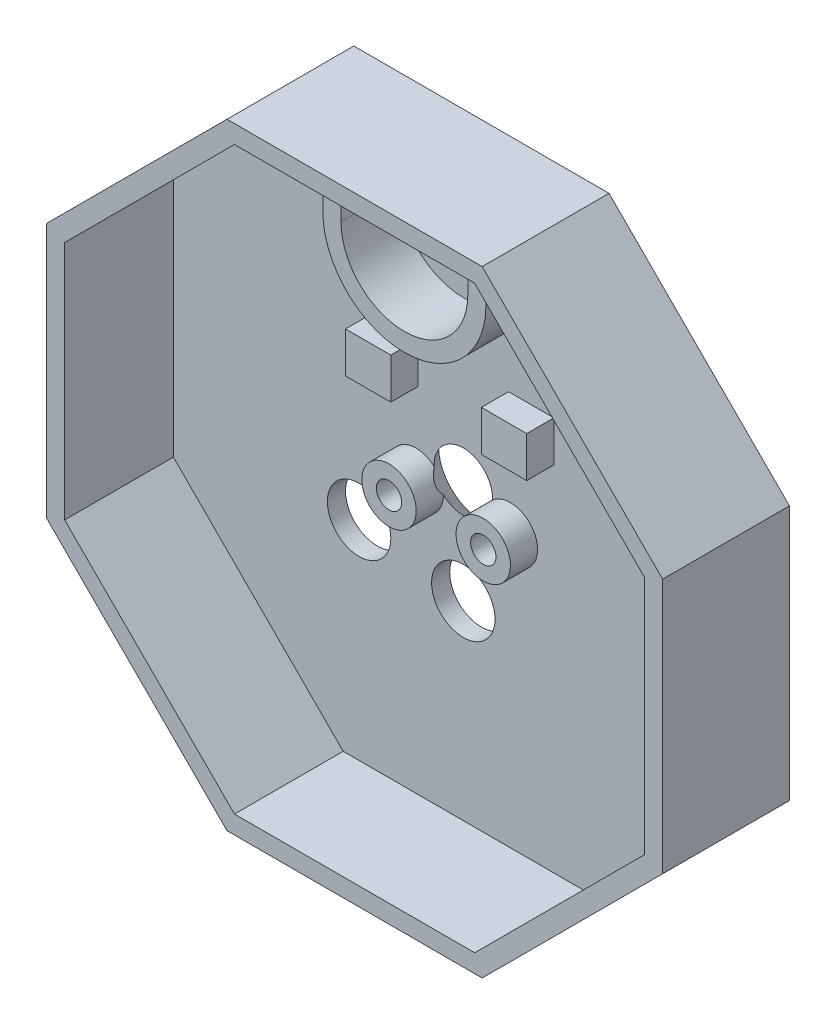
from build123d import *

# Parameters (mm, degrees)
BOSS_EXTRUDE1_DEPTH = 14
SHELL1_T            = -2
BOSS_EXTRUDE2_DEPTH = 6.5
SKETCH3_R           = 4.19
CUT_EXTRUDE1_DEPTH  = 50.558046773
SKETCH8_R           = 3
SKETCH8_R_2         = 1.4
BOSS_EXTRUDE3_DEPTH = 3
SKETCH9_W           = 5
SKETCH9_H           = 4.5
BOSS_EXTRUDE4_DEPTH = 3
SKETCH10_R          = 3.5
CUT_EXTRUDE2_DEPTH  = 51.079936102


with BuildPart() as part:
    # Sketch1 → Boss-Extrude1 (new body)
    with BuildSketch(Plane.XY):
        Polygon((34, -14.083261121), (34, 14.083261121), (14.083261121, 34), (-14.083261121, 34), (-34, 14.083261121), (-34, -14.083261121), (-14.083261121, -34), (14.083261121, -34), align=None)
    extrude(amount=BOSS_EXTRUDE1_DEPTH)

    # Shell1
    shell1_openings = [part.faces().sort_by_distance(p)[0] for p in [
        (0, 0, 14),
    ]]
    offset(amount=SHELL1_T, openings=shell1_openings, kind=Kind.INTERSECTION)

    # Sketch2 → Boss-Extrude2 (add)
    with BuildSketch(Plane.XY.offset(2)):
        with BuildLine():
            Line((7, 32), (7, 25))
            ThreePointArc((7, 25), (0, 18), (-7, 25))
            Line((-7, 25), (-7, 32))
            Line((-7, 32), (-9, 32))
            Line((-9, 32), (-9, 25))
            ThreePointArc((-9, 25), (0, 16), (9, 25))
            Line((9, 25), (9, 32))
            Line((9, 32), (7, 32))
        make_face()
    extrude(amount=BOSS_EXTRUDE2_DEPTH)

    # Sketch3 → Cut-Extrude1 (cut, through all)
    with BuildSketch(Plane.XY.offset(2)):
        with Locations((0, 25)):
            Circle(SKETCH3_R)
    extrude(amount=-CUT_EXTRUDE1_DEPTH, mode=Mode.SUBTRACT)

    # Sketch8 → Boss-Extrude3 (add)
    with BuildSketch(Plane.XY.offset(2)):
        with Locations(Location((-5.2, -2, 0), (0, 0, 90))):
            Circle(SKETCH8_R)
        with Locations(Location((-5.2, -2, 0), (0, 0, 90))):
            Circle(SKETCH8_R_2, mode=Mode.SUBTRACT)
    boss_extrude3 = extrude(amount=BOSS_EXTRUDE3_DEPTH)

    # Mirror1: Boss-Extrude3 across plane
    add(boss_extrude3.mirror(Plane(origin=(0, 0, 0), x_dir=(0, 0, 1), z_dir=(1, 0, 0))))

    # Sketch6 → Cut-Revolve1 (revolve, cut)
    with BuildSketch(Plane(origin=(0, 0, 0), x_dir=(0, 0, -1), z_dir=(1, 0, 0)), mode=Mode.PRIVATE) as cut_revolve1_sk:
        Polygon((-6.3, 0.4), (0, 0.4), (0, -4.325), align=None)
    revolve(cut_revolve1_sk.sketch.rotate(Axis((0, 0.4, 6.3), (0, 0, -1)), 87.429020802), axis=Axis((0, 0.4, 6.3), (0, 0, -1)), mode=Mode.SUBTRACT)

    # Sketch9 → Boss-Extrude4 (add)
    with BuildSketch(Plane.XY.offset(2)):
        with Locations((-7.5, 9.25)):
            Rectangle(SKETCH9_W, SKETCH9_H)
        with Locations((7.5, 9.25)):
            Rectangle(SKETCH9_W, SKETCH9_H)
    extrude(amount=BOSS_EXTRUDE4_DEPTH)

    # Sketch10 → Cut-Extrude2 (cut, through all)
    with BuildSketch(Plane(origin=(0, 0, 0), x_dir=(-1, 0, 0), z_dir=(0, 0, -1))):
        with Locations((11.5, -9)):
            Circle(SKETCH10_R)
        with Locations((0, -11)):
            Circle(SKETCH10_R)
    extrude(amount=-CUT_EXTRUDE2_DEPTH, mode=Mode.SUBTRACT)


solid = part.part
